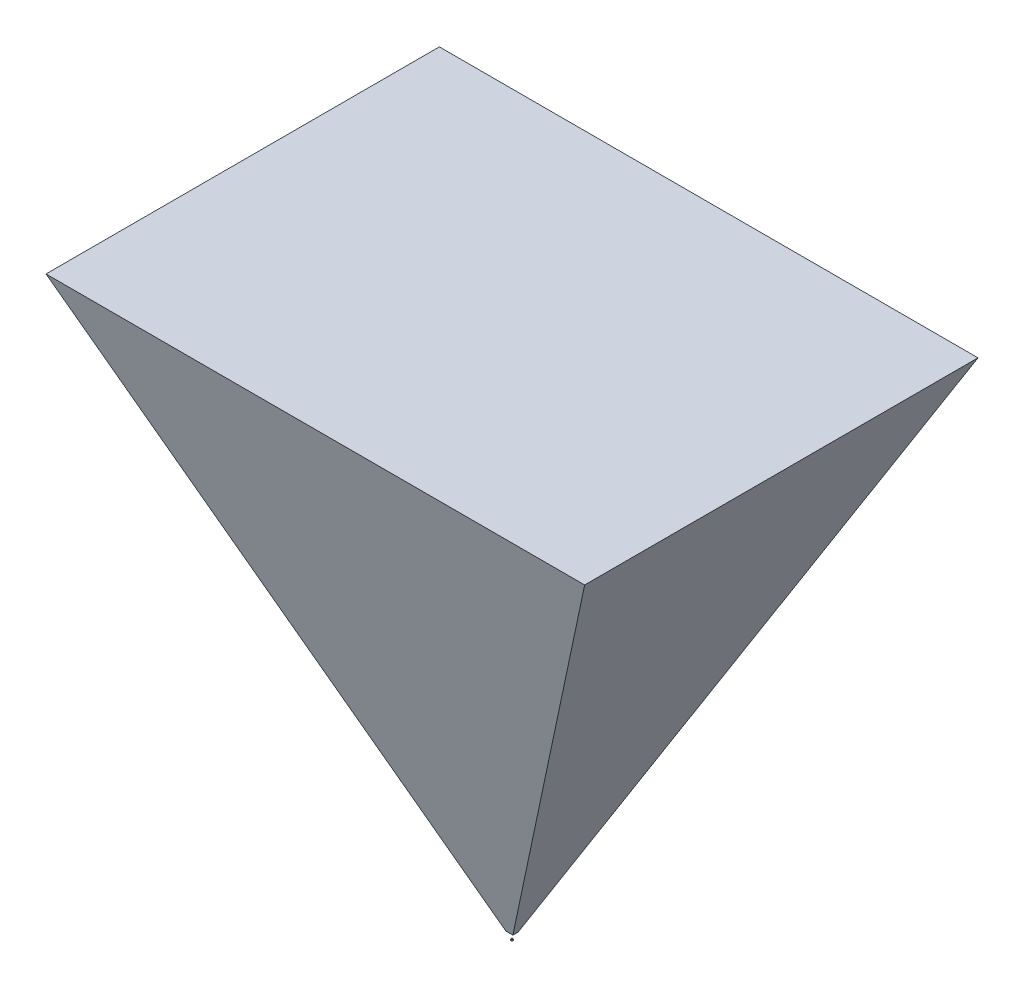
from build123d import *

# Parameters (mm, degrees)
SKIZZE4_W             = 0.25
SKIZZE4_H             = 1
TOOLFACE_ANGLE        = 60
KREISMUSTER1_COUNT    = 3
FOV_3_6MM_F_2_9_DEPTH = 1500
FOV2_DEPTH            = 2206.117266259
FOV2_DEPTH_BACK       = 2206.117266259
SKIZZE8_OUTSIDE_W     = 3710.194
SKIZZE8_OUTSIDE_H     = 2231.452
SKIZZE8_OUTSIDE_R     = 5


with BuildPart() as part:
    # Skizze3 → Body (revolve)
    with BuildSketch(Plane.XY, mode=Mode.PRIVATE) as body_sk:
        with BuildLine():
            Line((1, 0.8), (2.75, 0.8))
            Line((2.75, 0.8), (2.75, -2.55))
            Line((2.75, -2.55), (2.1, -2.55))
            Line((2.1, -2.55), (1.8, -2.25))
            ThreePointArc((1.8, -2.25), (0.91241438, -2.474486277), (0, -2.55))
            Line((0, -2.55), (0, 0.525))
            ThreePointArc((0, 0.525), (0.316474723, 0.499842016), (0.625, 0.425))
            Line((0.625, 0.425), (1, 0.8))
        make_face()
    revolve(body_sk.sketch.rotate(Axis((0, 0, 0), (0, -1, 0)), 90), axis=Axis((0, 0, 0), (0, -1, 0)))

    # Skizze4 → Thread (revolve)
    with BuildSketch(Plane.XY):
        with Locations((2.875, -0.7)):
            Rectangle(SKIZZE4_W, SKIZZE4_H)
    revolve(axis=Axis((0, 0, 0), (0, 1, 0)))

    # Skizze5 → Toolface (revolve, cut)
    with BuildSketch(Plane(origin=(0, 0, 0), x_dir=(0, 0, -1), z_dir=(1, 0, 0))):
        Polygon((2.75, 0.8), (2.75, 0.35), (2.3, 0.8), align=None)
    toolface = revolve(axis=Axis((0, 0, 0), (0, -1, 0)), revolution_arc=TOOLFACE_ANGLE, mode=Mode.SUBTRACT)

    # Kreismuster1: Toolface ×3 about axis
    kreismuster1_axis = Axis((0, 0, 0), (0, 1, 0))
    for i in range(1, KREISMUSTER1_COUNT):
        add(toolface.rotate(kreismuster1_axis, i * 360 / KREISMUSTER1_COUNT), mode=Mode.SUBTRACT)


with BuildPart() as body_2:
    # Skizze6 → FOV - 3,6mm f/2,9 (new, symmetric)
    with BuildSketch(Plane(origin=(0, 0, 0), x_dir=(0, 0, -1), z_dir=(1, 0, 0))):
        Polygon((-7.279404685, 18.707826613), (-553.234756085, 1518.707826613), (553.234756085, 1518.707826613), (7.279404685, 18.707826613), align=None)
    extrude(amount=FOV_3_6MM_F_2_9_DEPTH, both=True)

    # Skizze8 outside → FOV2 (cut, two sides: drawn at the far end of the back side and taken through both)
    with BuildSketch(Plane.XY.offset(-FOV2_DEPTH_BACK)):
        with Locations((0, 758.079)):
            Rectangle(SKIZZE8_OUTSIDE_W, SKIZZE8_OUTSIDE_H)
        Circle(SKIZZE8_OUTSIDE_R, mode=Mode.SUBTRACT)
        Polygon((-9.740481092, 18.707826613), (-757.612893173, 1518.707826613), (757.612893173, 1518.707826613), (9.740481092, 18.707826613), align=None, mode=Mode.SUBTRACT)
    extrude(amount=FOV2_DEPTH + FOV2_DEPTH_BACK, mode=Mode.SUBTRACT)


solid = Compound([part.part, body_2.part])
